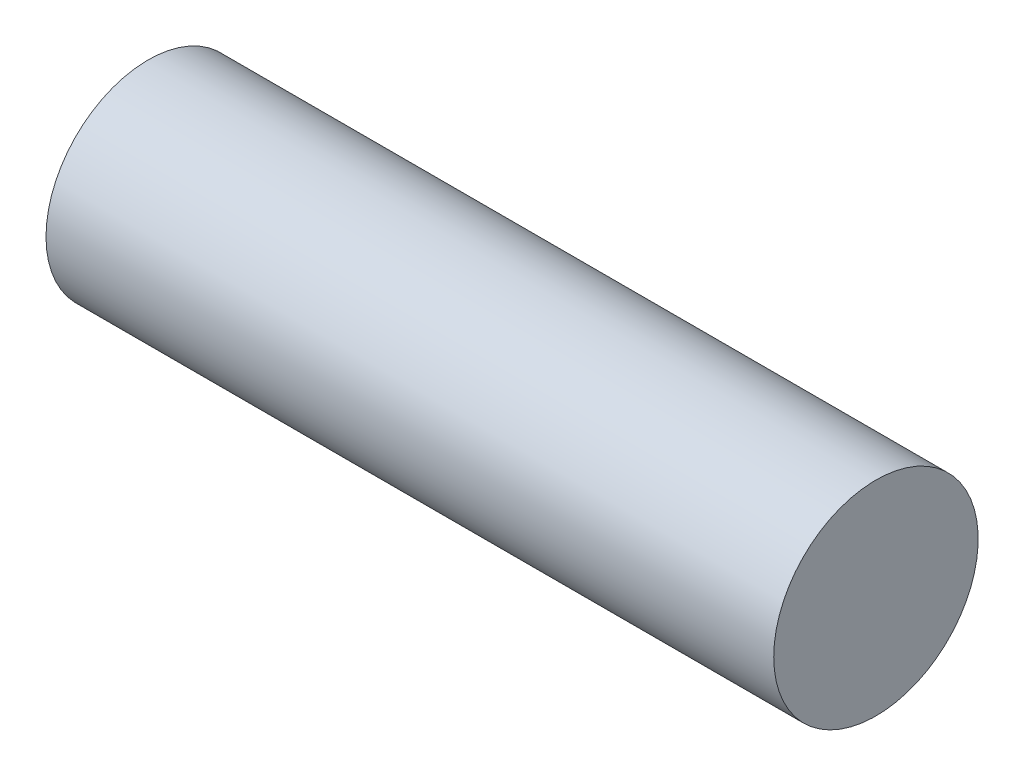
from build123d import *

# Parameters (mm, degrees)
ESQUISSE1_W = 315.189187025
ESQUISSE1_H = 44.271024873


with BuildPart() as part:
    # Esquisse1 → Révolution1 (revolve)
    with BuildSketch(Plane.XY, mode=Mode.PRIVATE) as r_volution1_sk:
        with Locations((-176.766472447, 22.135512437)):
            Rectangle(ESQUISSE1_W, ESQUISSE1_H)
    revolve(r_volution1_sk.sketch.rotate(Axis((-334.361065959, 0, 0), (1, 0, 0)), 90), axis=Axis((-334.361065959, 0, 0), (1, 0, 0)))


solid = part.part
